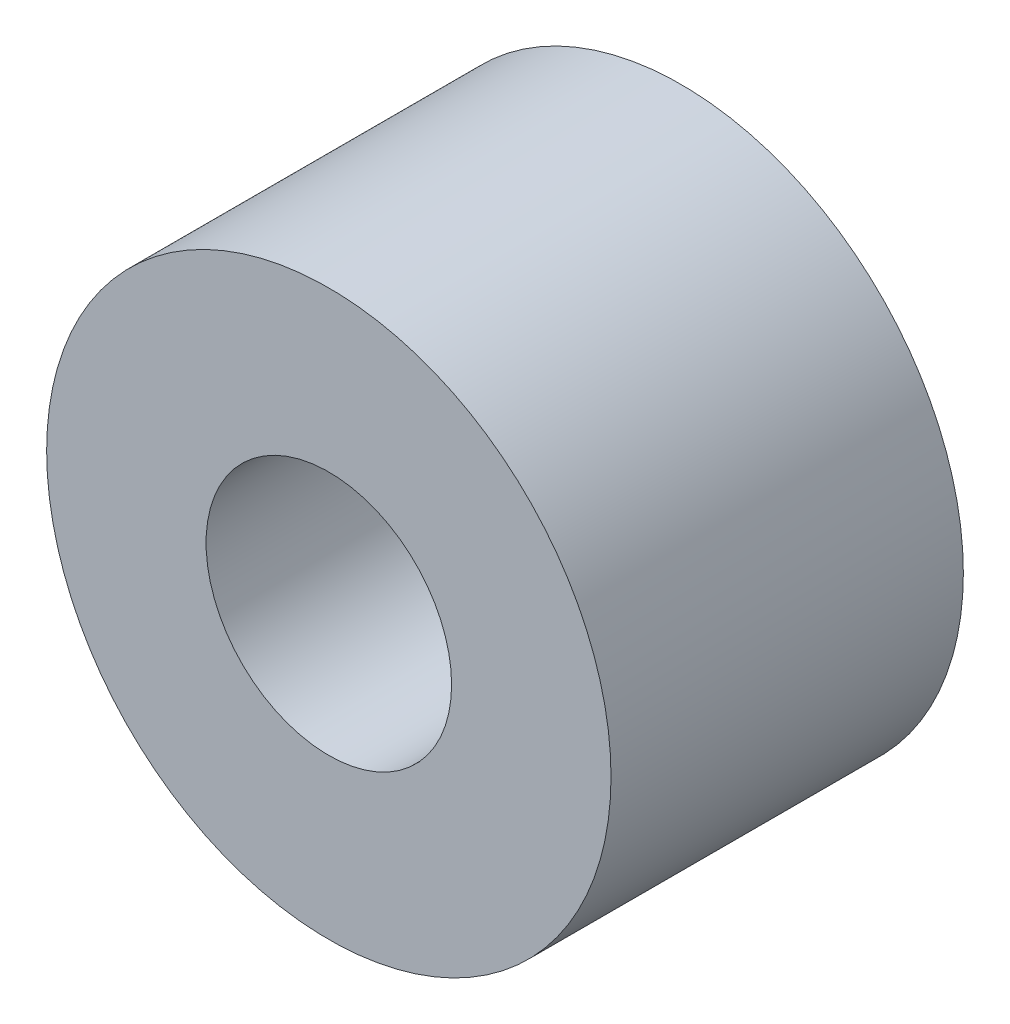
from build123d import *

# Parameters (mm, degrees)
SKETCH1_R           = 11.2395
SKETCH1_R_2         = 4.8895
BOSS_EXTRUDE1_DEPTH = 14.0335


with BuildPart() as part:
    # Sketch1 → Boss-Extrude1 (new body)
    with BuildSketch(Plane.XY):
        Circle(SKETCH1_R)
        Circle(SKETCH1_R_2, mode=Mode.SUBTRACT)
    extrude(amount=BOSS_EXTRUDE1_DEPTH)


solid = part.part
